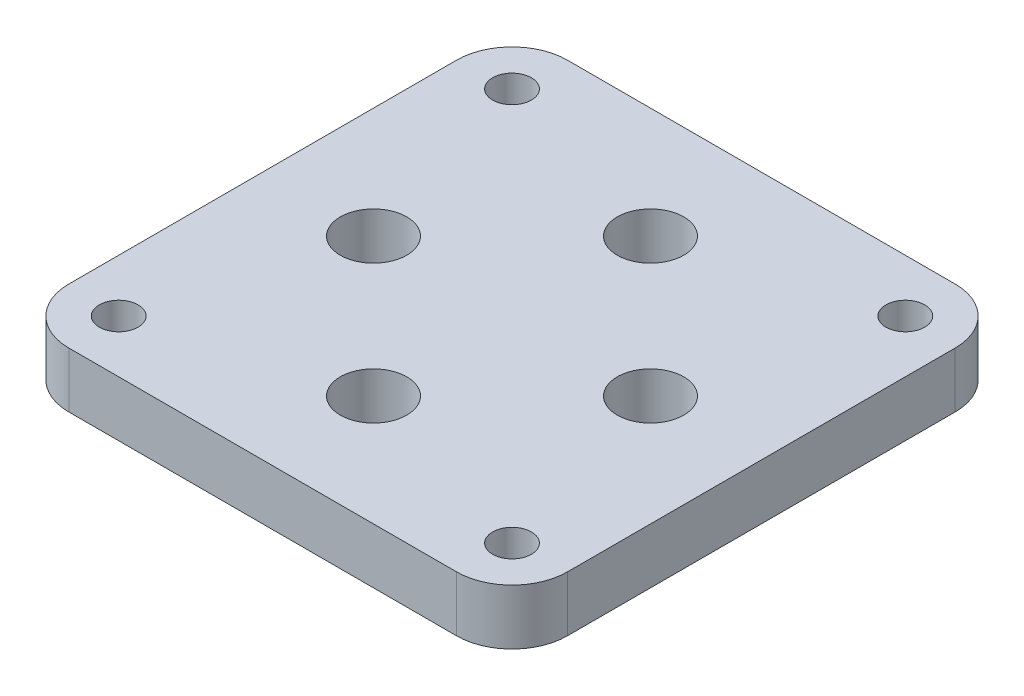
from build123d import *

# Parameters (mm, degrees)
SKETCH1_W            = 90
SKETCH1_H            = 90
BOSS_EXTRUDE1_DEPTH  = 10
M6_CLEARANCE_HOLE2_D = 7
SKETCH3_R            = 6
CUT_EXTRUDE2_DEPTH   = 26
FILLET1_R            = 10


with BuildPart() as part:
    # Sketch1 → Boss-Extrude1 (new body)
    with BuildSketch(Plane(origin=(0, 0, 0), x_dir=(1, 0, 0), z_dir=(0, 1, 0))):
        Rectangle(SKETCH1_W, SKETCH1_H)
    extrude(amount=BOSS_EXTRUDE1_DEPTH)

    # M6 Clearance Hole2 (through all)
    with Locations(Plane(origin=(-35.5, 10, -35.5), x_dir=(0, 0, 1), z_dir=(0, 1, 0))):
        with Locations((0, 0), (0, 71), (71, 0), (71, 71)):
            Hole(M6_CLEARANCE_HOLE2_D / 2)

    # Sketch3 → Cut-Extrude2 (cut)
    with BuildSketch(Plane(origin=(0, 10, 0), x_dir=(1, 0, 0), z_dir=(0, 1, 0))):
        with Locations(Location((0, 25, 0), (0, 0, 270))):
            Circle(SKETCH3_R)
        with Locations(Location((-25, 0, 0), (0, 0, 270))):
            Circle(SKETCH3_R)
        with Locations(Location((0, -25, 0), (0, 0, 270))):
            Circle(SKETCH3_R)
        with Locations(Location((25, 0, 0), (0, 0, 270))):
            Circle(SKETCH3_R)
    extrude(amount=-CUT_EXTRUDE2_DEPTH, mode=Mode.SUBTRACT)

    # Fillet1
    fillet1_edges = [part.edges().sort_by_distance(p)[0] for p in [
        (45, 5, 45),
        (-45, 5, 45),
        (-45, 5, -45),
        (45, 5, -45),
    ]]
    fillet(fillet1_edges, radius=FILLET1_R)


solid = part.part
